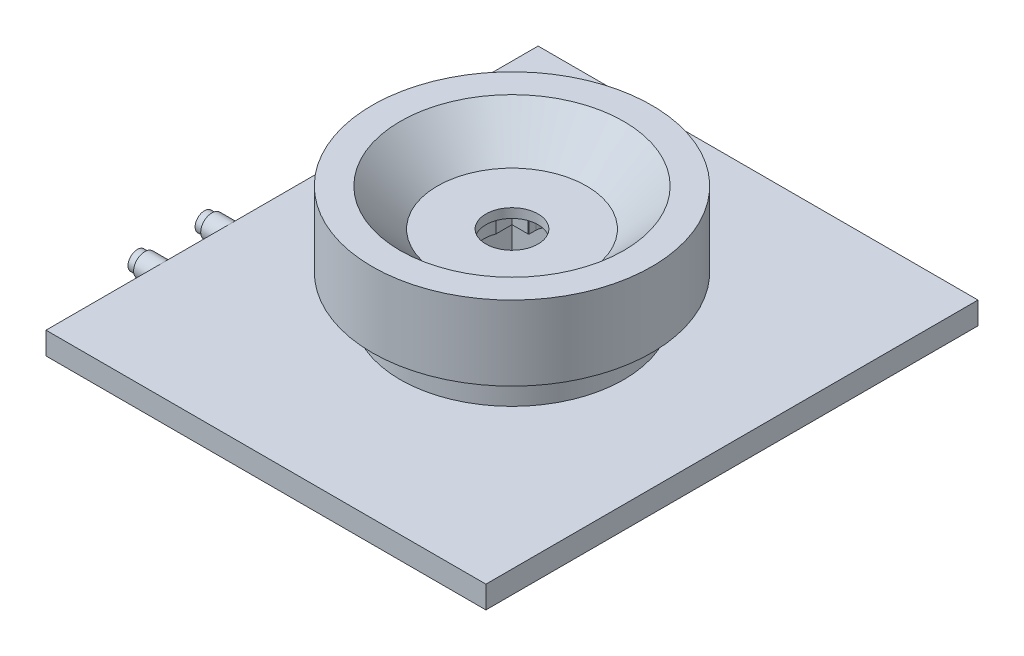
from build123d import *

# Parameters (mm, degrees)
SKETCH_1_W          = 118
SKETCH_1_H          = 132
EXTRUDE_1_DEPTH     = 6
SKETCH_2_W          = 110
SKETCH_2_H          = 125
CUT_EXTRUDE_1_DEPTH = 2
SKETCH_3_R          = 30
EXTRUDE_2_DEPTH     = 10
SKETCH_4_R          = 37.5
EXTRUDE_3_DEPTH     = 20
SKETCH_6_R          = 20
SKETCH_7_R          = 30
SKETCH_8_R          = 1.6
CUT_EXTRUDE_2_DEPTH = 2.2
SKETCH_10_W         = 34
SKETCH_10_H         = 34
CUT_EXTRUDE_3_DEPTH = 18
CUT_EXTRUDE_4_DEPTH = 3.5
SKETCH_12_R         = 7
CUT_EXTRUDE_5_DEPTH = 93.265920036
SKETCH_13_R         = 1.35
CUT_EXTRUDE_6_DEPTH = 2
SKETCH_14_R         = 3
EXTRUDE_4_DEPTH     = 5
SKETCH_15_R         = 2.5
EXTRUDE_5_DEPTH     = 2
SKETCH_16_R         = 2.5
CUT_EXTRUDE_7_DEPTH = 5


with BuildPart() as part:
    # 草图1 → 凸台-拉伸1 (new body)
    with BuildSketch(Plane(origin=(0, 0, 0), x_dir=(1, 0, 0), z_dir=(0, 1, 0))):
        Rectangle(SKETCH_1_W, SKETCH_1_H)
    extrude(amount=EXTRUDE_1_DEPTH)

    # 草图2 → 切除-拉伸1 (cut)
    with BuildSketch(Plane.XZ):
        Rectangle(SKETCH_2_W, SKETCH_2_H)
    extrude(amount=-CUT_EXTRUDE_1_DEPTH, mode=Mode.SUBTRACT)

    # 草图3 → 凸台-拉伸2 (add)
    with BuildSketch(Plane(origin=(0, 6, 0), x_dir=(1, 0, 0), z_dir=(0, 1, 0))):
        with Locations(Location((0, 0, 0), (0, 0, 270))):
            Circle(SKETCH_3_R)
    extrude(amount=EXTRUDE_2_DEPTH)

    # 草图4 → 凸台-拉伸3 (add)
    with BuildSketch(Plane(origin=(0, 16, 0), x_dir=(1, 0, 0), z_dir=(0, 1, 0))):
        with Locations(Location((0, 0, 0), (0, 0, 270))):
            Circle(SKETCH_4_R)
    extrude(amount=EXTRUDE_3_DEPTH)

    # 草图6 → 切除-放样2 section 0
    with BuildSketch(Plane(origin=(0, 26, 0), x_dir=(1, 0, 0), z_dir=(0, 1, 0))):
        Circle(SKETCH_6_R)
    # 草图7 → 切除-放样2 section 1
    with BuildSketch(Plane(origin=(0, 36, 0), x_dir=(1, 0, 0), z_dir=(0, 1, 0))):
        Circle(SKETCH_7_R)
    loft(mode=Mode.SUBTRACT)

    # 草图8 → 切除-拉伸2 (cut)
    with BuildSketch(Plane.XZ.offset(-2)):
        with Locations(Location((52.5, 60, 0), (0, 0, 270))):
            Circle(SKETCH_8_R)
        with Locations(Location((52.5, -60, 0), (0, 0, 270))):
            Circle(SKETCH_8_R)
        with Locations(Location((-52.5, -60, 0), (0, 0, 270))):
            Circle(SKETCH_8_R)
        with Locations(Location((-52.5, 60, 0), (0, 0, 270))):
            Circle(SKETCH_8_R)
    extrude(amount=-CUT_EXTRUDE_2_DEPTH, mode=Mode.SUBTRACT)

    # 草图10 → 切除-拉伸3 (cut)
    with BuildSketch(Plane.XZ.offset(-2)):
        Rectangle(SKETCH_10_W, SKETCH_10_H)
    extrude(amount=-CUT_EXTRUDE_3_DEPTH, mode=Mode.SUBTRACT)

    # 草图11 → 切除-拉伸4 (cut)
    with BuildSketch(Plane.XZ.offset(-20)):
        with BuildLine():
            Line((-2.687978229, -7), (-7, -7))
            Line((-7, -7), (-7, -2.690813124))
            ThreePointArc((-7, -2.690813124), (-7.5, 0.001769279), (-7, 2.694351683))
            Line((-7, 2.694351683), (-7, 7))
            Line((-7, 7), (-2.697177558, 7))
            ThreePointArc((-2.697177558, 7), (-2.598843965, 7.03710936), (-2.5, 7.072837091))
            Line((-2.5, 7.072837091), (-2.5, 9.133061324))
            ThreePointArc((-2.5, 9.133061324), (0, 11.503538559), (2.5, 9.133061324))
            Line((2.5, 9.133061324), (2.5, 7.072837091))
            ThreePointArc((2.5, 7.072837091), (2.598843965, 7.03710936), (2.697177558, 7))
            Line((2.697177558, 7), (7, 7))
            Line((7, 7), (7, 2.694351683))
            ThreePointArc((7, 2.694351683), (7.5, 0.001769279), (7, -2.690813124))
            Line((7, -2.690813124), (7, -7))
            Line((7, -7), (2.687978229, -7))
            ThreePointArc((2.687978229, -7), (2.594220518, -7.035276969), (2.5, -7.069298532))
            Line((2.5, -7.069298532), (2.5, -9))
            ThreePointArc((2.5, -9), (0, -11.5), (-2.5, -9))
            Line((-2.5, -9), (-2.5, -7.069298532))
            ThreePointArc((-2.5, -7.069298532), (-2.594220518, -7.035276969), (-2.687978229, -7))
        make_face()
    extrude(amount=-CUT_EXTRUDE_4_DEPTH, mode=Mode.SUBTRACT)

    # 草图12 → 切除-拉伸5 (cut, through all)
    with BuildSketch(Plane(origin=(0, 26, 0), x_dir=(1, 0, 0), z_dir=(0, 1, 0))):
        with Locations(Location((0, 0, 0), (0, 0, 270))):
            Circle(SKETCH_12_R)
    extrude(amount=-CUT_EXTRUDE_5_DEPTH, mode=Mode.SUBTRACT)

    # 草图13 → 切除-拉伸6 (cut)
    with BuildSketch(Plane.XZ.offset(-20)):
        with Locations(Location((-14, 14, 0), (0, 0, 270))):
            Circle(SKETCH_13_R)
        with Locations(Location((14, 14, 0), (0, 0, 270))):
            Circle(SKETCH_13_R)
        with Locations(Location((14, -14, 0), (0, 0, 270))):
            Circle(SKETCH_13_R)
        with Locations(Location((-14, -14, 0), (0, 0, 270))):
            Circle(SKETCH_13_R)
    extrude(amount=-CUT_EXTRUDE_6_DEPTH, mode=Mode.SUBTRACT)

    # 草图14 → 凸台-拉伸4 (add)
    with BuildSketch(Plane.ZY.offset(59)):
        with Locations(Location((34.5, 3, 0), (0, 0, 270))):
            Circle(SKETCH_14_R)
        with Locations(Location((16.5, 3, 0), (0, 0, 270))):
            Circle(SKETCH_14_R)
    extrude(amount=EXTRUDE_4_DEPTH)

    # 草图15 → 凸台-拉伸5 (add)
    with BuildSketch(Plane.ZY.offset(64)):
        with Locations((16.5, 3)):
            Circle(SKETCH_15_R)
        with Locations((34.5, 3)):
            Circle(SKETCH_15_R)
    extrude(amount=EXTRUDE_5_DEPTH)

    # 草图16 → 切除-拉伸7 (cut)
    with BuildSketch(Plane.ZY.offset(59)):
        with Locations((-28.664816868, 3)):
            Circle(SKETCH_16_R)
    extrude(amount=-CUT_EXTRUDE_7_DEPTH, mode=Mode.SUBTRACT)


solid = part.part
